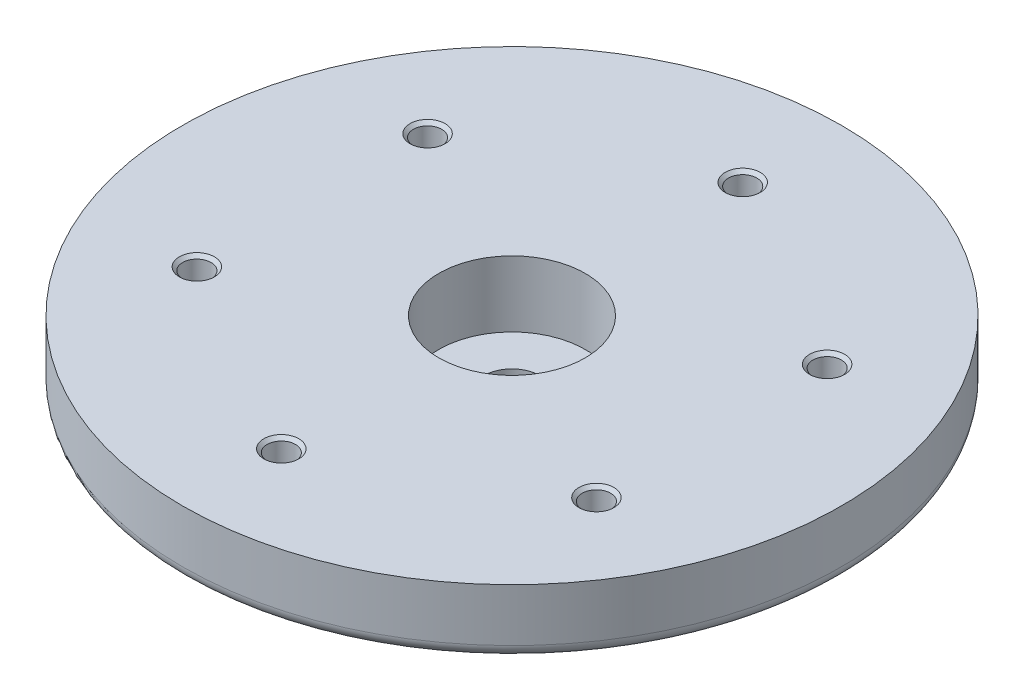
from build123d import *

# Parameters (mm, degrees)
SKETCH1_R           = 12.5
BOSS_EXTRUDE1_DEPTH = 10
BOSS_EXTRUDE2_DEPTH = 10
CIRPATTERN1_COUNT   = 15
SKETCH2_R           = 4.25
CUT_EXTRUDE1_DEPTH  = 10
FILLET1_R           = 0.75
SKETCH3_R           = 50
SKETCH3_R_2         = 11.11
SKETCH3_R_3         = 2.155
BOSS_EXTRUDE3_DEPTH = 10
CHAMFER1_SIZE       = 0.5
FILLET2_R           = 2


with BuildPart() as part:
    # Sketch1 → Boss-Extrude1 (new body)
    with BuildSketch(Plane(origin=(0, 0, 0), x_dir=(1, 0, 0), z_dir=(0, 1, 0))):
        with Locations(Location((0, 0, 0), (0, 0, 270))):
            Circle(SKETCH1_R)
    extrude(amount=BOSS_EXTRUDE1_DEPTH)

    # Sketch1<3> → Boss-Extrude2 (add)
    with BuildSketch(Plane(origin=(0, 0, 0), x_dir=(1, 0, 0), z_dir=(0, 1, 0))):
        with BuildLine():
            Line((0.75, 17), (0, 17))
            Line((0, 17), (-0.75, 17))
            ThreePointArc((-0.75, 17), (-1.587894674, 14.78046783), (-1.5, 12.409673646))
            ThreePointArc((-1.5, 12.409673646), (0, 12.5), (1.5, 12.409673646))
            ThreePointArc((1.5, 12.409673646), (1.587894674, 14.78046783), (0.75, 17))
        make_face()
    boss_extrude2 = extrude(amount=BOSS_EXTRUDE2_DEPTH)

    # CirPattern1: Boss-Extrude2 ×15 about axis
    cirpattern1_axis = Axis((0, 0, 0), (0, 1, 0))
    for i in range(1, CIRPATTERN1_COUNT):
        add(boss_extrude2.rotate(cirpattern1_axis, i * 360 / CIRPATTERN1_COUNT))

    # Sketch2 → Cut-Extrude1 (cut)
    with BuildSketch(Plane(origin=(0, 10, 0), x_dir=(1, 0, 0), z_dir=(0, 1, 0))):
        with Locations(Location((0, 0, 0), (0, 0, 270))):
            Circle(SKETCH2_R)
    extrude(amount=-CUT_EXTRUDE1_DEPTH, mode=Mode.SUBTRACT)

    # Fillet1
    fillet1_edges = [part.edges().sort_by_distance(p)[0] for p in [
        (8.507748646, 5, 9.157958996),
        (9.99709263, 5, 7.503874929),
        (14.347431864, 5, 9.149519053),
        (15.097431864, 5, 7.850480947),
        (11.49709263, 5, 4.905798717),
        (12.18489946, 5, 2.788946959),
        (16.828475874, 5, 2.522875297),
        (16.985268569, 5, 1.031092454),
        (12.49848485, 5, -0.194618727),
        (12.265826478, 5, -2.408215277),
        (16.399723523, 5, -4.539996517),
        (15.936198031, 5, -5.966581292),
        (11.338775495, 5, -5.261384826),
        (10.225880665, 5, -7.188975213),
        (13.135309988, 5, -10.817861689),
        (12.131614078, 5, -11.932578927),
        (8.218488846, 5, -9.41840969),
        (6.417787187, 5, -10.726696026),
        (7.599682026, 5, -15.225220298),
        (6.229363839, 5, -15.835325262),
        (3.677150814, 5, -11.946905955),
        (-3.677150814, 5, -11.946905955),
        (-6.229363839, 5, -15.835325262),
        (-7.599682026, 5, -15.225220298),
        (-6.417787187, 5, -10.726696026),
        (-8.218488846, 5, -9.41840969),
        (-12.131614078, 5, -11.932578927),
        (-13.135309988, 5, -10.817861689),
        (-10.225880665, 5, -7.188975213),
        (-11.338775495, 5, -5.261384826),
        (-15.936198031, 5, -5.966581292),
        (-16.399723523, 5, -4.539996517),
        (-12.265826478, 5, -2.408215277),
        (-12.49848485, 5, -0.194618727),
        (-16.985268569, 5, 1.031092454),
        (-16.828475874, 5, 2.522875297),
        (-12.18489946, 5, 2.788946959),
        (-11.49709263, 5, 4.905798717),
        (-15.097431864, 5, 7.850480947),
        (-14.347431864, 5, 9.149519053),
        (-9.99709263, 5, 7.503874929),
        (-8.507748646, 5, 9.157958996),
        (-10.599112035, 5, 13.312449965),
        (-9.385586543, 5, 14.194127844),
        (-6.080697663, 5, 10.921314753),
        (1.5, 5, -12.409673646),
        (-4.047337631, 5, 11.826624966),
        (-4.268109444, 5, 16.472575444),
        (-2.800888043, 5, 16.784442981),
        (-1.112894829, 5, 12.450360039),
        (0.75, 5, -17),
        (1.112894829, 5, 12.450360039),
        (-0.75, 5, -17),
        (2.800888043, 5, 16.784442981),
        (4.268109444, 5, 16.472575444),
        (4.047337631, 5, 11.826624966),
        (-1.5, 5, -12.409673646),
        (6.080697663, 5, 10.921314753),
        (9.385586543, 5, 14.194127844),
        (10.599112035, 5, 13.312449965),
    ]]
    fillet(fillet1_edges, radius=FILLET1_R)

    # Sketch3 → Boss-Extrude3 (add)
    with BuildSketch(Plane(origin=(0, 10, 0), x_dir=(1, 0, 0), z_dir=(0, 1, 0))):
        with Locations(Location((0, 0, 0), (0, 0, 270))):
            Circle(SKETCH3_R)
        with Locations(Location((0, 0, 0), (0, 0, 270))):
            Circle(SKETCH3_R_2, mode=Mode.SUBTRACT)
        with Locations(Location((0, 35, 0), (0, 0, 270))):
            Circle(SKETCH3_R_3, mode=Mode.SUBTRACT)
        with Locations(Location((30.310889132, 17.5, 0), (0, 0, 270))):
            Circle(SKETCH3_R_3, mode=Mode.SUBTRACT)
        with Locations(Location((30.310889132, -17.5, 0), (0, 0, 270))):
            Circle(SKETCH3_R_3, mode=Mode.SUBTRACT)
        with Locations(Location((0, -35, 0), (0, 0, 270))):
            Circle(SKETCH3_R_3, mode=Mode.SUBTRACT)
        with Locations(Location((-30.310889132, -17.5, 0), (0, 0, 270))):
            Circle(SKETCH3_R_3, mode=Mode.SUBTRACT)
        with Locations(Location((-30.310889132, 17.5, 0), (0, 0, 270))):
            Circle(SKETCH3_R_3, mode=Mode.SUBTRACT)
    extrude(amount=BOSS_EXTRUDE3_DEPTH)

    # Chamfer1
    chamfer1_edges = [part.edges().sort_by_distance(p)[0] for p in [
        (0, 20, -37.155),
        (30.310889132, 20, -19.655),
        (30.310889132, 20, 15.345),
        (0, 20, 32.845),
        (-30.310889132, 20, 15.345),
        (-30.310889132, 20, -19.655),
    ]]
    chamfer(chamfer1_edges, length=CHAMFER1_SIZE)

    # Fillet2
    fillet2_edges = [part.edges().sort_by_distance(p)[0] for p in [
        (0, 10, -50),
    ]]
    fillet(fillet2_edges, radius=FILLET2_R)


solid = part.part
